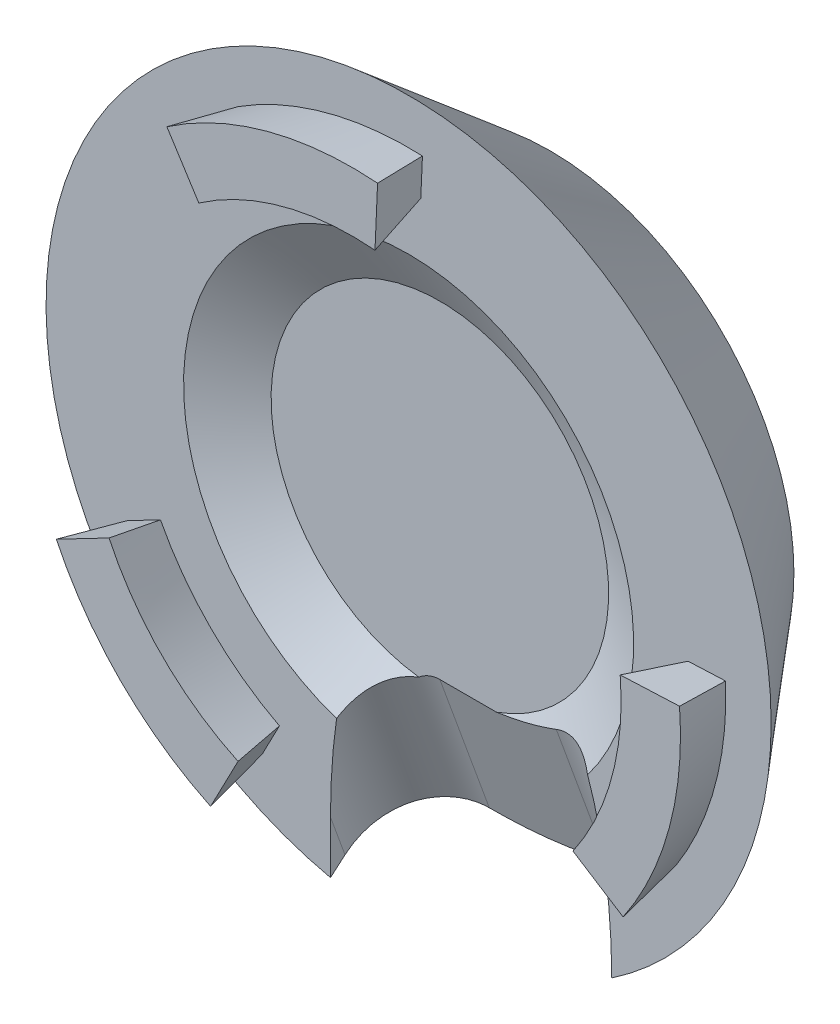
from build123d import *

# Parameters (mm, degrees)
BOSS_EXTRUDE1_DEPTH      = 0.9
BOSS_EXTRUDE1_DRAFT      = -11
CIRPATTERN1_COPY_1_DEPTH = 0.9
CIRPATTERN1_COPY_1_DRAFT = -11
CIRPATTERN1_COPY_2_DEPTH = 0.9
CIRPATTERN1_COPY_2_DRAFT = -11
CUT_EXTRUDE2_REACH       = 14.838


with BuildPart() as part:
    # Sketch1 → Revolve1 (revolve)
    with BuildSketch(Plane(origin=(0, 0, 0), x_dir=(0, 0, -1), z_dir=(1, 0, 0)), mode=Mode.PRIVATE) as revolve1_sk:
        Polygon((0, 5.8), (2.264331826, 3.9), (2.264331826, 0), (0.5, 0), (0.5, 2.7), (0, 3.6), align=None)
    revolve(revolve1_sk.sketch.rotate(Axis((0, 0, 0), (0, 0, -1)), 90), axis=Axis((0, 0, 0), (0, 0, -1)))


with BuildPart() as boss_extrude1_tool:
    # Sketch7 → Boss-Extrude1 (with draft: the straight prism first)
    with BuildSketch(Plane.XY):
        with BuildLine():
            Line((-2.726795512, 4.280211588), (-2.404415747, 3.77417672))
            ThreePointArc((-2.404415747, 3.77417672), (-1.158215227, 4.322518073), (0.195196758, 4.470740792))
            Line((0.195196758, 4.470740792), (0.221368391, 5.070169725))
            ThreePointArc((0.221368391, 5.070169725), (-1.313506654, 4.902073568), (-2.726795512, 4.280211588))
        make_face()
    extrude(amount=BOSS_EXTRUDE1_DEPTH)
    # Boss-Extrude1: the draft: its side faces are tilted about the plane it starts from
    boss_extrude1_sides = [boss_extrude1_tool.faces().sort_by_distance(p)[0] for p in [
        (0.208282575, 4.770455258, 0.45),
        (-1.313506654, 4.902073568, 0.45),
        (-2.56560563, 4.027194154, 0.45),
        (-1.158215227, 4.322518073, 0.45),
    ]]
    draft(boss_extrude1_sides, Plane.XY, BOSS_EXTRUDE1_DRAFT)


with BuildPart() as part_1:
    add(part.part)

    # Boss-Extrude1: add boss_extrude1_tool
    add(boss_extrude1_tool.part)


with BuildPart() as cirpattern1_copy_1_tool:
    # CirPattern1 copy 1 sketch → CirPattern1 copy 1 (with draft: the straight prism first)
    with BuildSketch(Plane(origin=(0, 0, 0), x_dir=(-0.4999999999999998, 0.8660254037844387, 0), z_dir=(0, 0, 1))):
        with BuildLine():
            Line((-2.726795512, 4.280211588), (-2.404415747, 3.77417672))
            ThreePointArc((-2.404415747, 3.77417672), (-1.158215227, 4.322518073), (0.195196758, 4.470740792))
            Line((0.195196758, 4.470740792), (0.221368391, 5.070169725))
            ThreePointArc((0.221368391, 5.070169725), (-1.313506654, 4.902073568), (-2.726795512, 4.280211588))
        make_face()
    extrude(amount=CIRPATTERN1_COPY_1_DEPTH)
    # CirPattern1 copy 1: the draft: its side faces are tilted about the plane it starts from
    cirpattern1_copy_1_sides = [cirpattern1_copy_1_tool.faces().sort_by_distance(p)[0] for p in [
        (-4.235476729, -2.204849628, 0.45),
        (-3.588566914, -3.588566914, 0.45),
        (-2.204849628, -4.235476729, 0.45),
        (-3.164302846, -3.164302846, 0.45),
    ]]
    draft(cirpattern1_copy_1_sides, Plane(origin=(0, 0, 0), x_dir=(-0.4999999999999998, 0.8660254037844387, 0), z_dir=(0, 0, 1)), CIRPATTERN1_COPY_1_DRAFT)


with BuildPart() as part_2:
    add(part_1.part)

    # CirPattern1 copy 1: add cirpattern1_copy_1_tool
    add(cirpattern1_copy_1_tool.part)


with BuildPart() as cirpattern1_copy_2_tool:
    # CirPattern1 copy 2 sketch → CirPattern1 copy 2 (with draft: the straight prism first)
    with BuildSketch(Plane(origin=(0, 0, 0), x_dir=(-0.5000000000000004, -0.8660254037844384, 0), z_dir=(0, 0, 1))):
        with BuildLine():
            Line((-2.726795512, 4.280211588), (-2.404415747, 3.77417672))
            ThreePointArc((-2.404415747, 3.77417672), (-1.158215227, 4.322518073), (0.195196758, 4.470740792))
            Line((0.195196758, 4.470740792), (0.221368391, 5.070169725))
            ThreePointArc((0.221368391, 5.070169725), (-1.313506654, 4.902073568), (-2.726795512, 4.280211588))
        make_face()
    extrude(amount=CIRPATTERN1_COPY_2_DEPTH)
    # CirPattern1 copy 2: the draft: its side faces are tilted about the plane it starts from
    cirpattern1_copy_2_sides = [cirpattern1_copy_2_tool.faces().sort_by_distance(p)[0] for p in [
        (4.027194154, -2.56560563, 0.45),
        (4.902073568, -1.313506654, 0.45),
        (4.770455258, 0.208282575, 0.45),
        (4.322518073, -1.158215227, 0.45),
    ]]
    draft(cirpattern1_copy_2_sides, Plane(origin=(0, 0, 0), x_dir=(-0.5000000000000004, -0.8660254037844384, 0), z_dir=(0, 0, 1)), CIRPATTERN1_COPY_2_DRAFT)


with BuildPart() as part_3:
    add(part_2.part)

    # CirPattern1 copy 2: add cirpattern1_copy_2_tool
    add(cirpattern1_copy_2_tool.part)

    # Sketch11 → Cut-Extrude2 (cut, up to next)
    with BuildSketch(Plane(origin=(0, -5.298133329, -1.928362829), x_dir=(-1, 0, 0), z_dir=(0, -0.9396926207859081, -0.34202014332566943)), mode=Mode.PRIVATE) as cut_extrude2_sk1:
        with BuildLine():
            Line((0, -0.4), (-2, -0.4))
            ThreePointArc((-2, -0.4), (-2.883883476, -0.766116524), (-3.25, -1.65))
            Line((-3.25, -1.65), (-3.25, -2.9))
            Line((-3.25, -2.9), (-2, -2.9))
            Line((-2, -2.9), (0, -2.9))
            Line((0, -2.9), (1.25, -2.9))
            Line((1.25, -2.9), (1.25, -1.65))
            ThreePointArc((1.25, -1.65), (0.883883476, -0.766116524), (0, -0.4))
        make_face()
    cut_extrude2_tool1 = extrude(cut_extrude2_sk1.sketch, amount=-CUT_EXTRUDE2_REACH, mode=Mode.PRIVATE) & part_3.part
    add(cut_extrude2_tool1.solids().sort_by_distance((1, -5.883514, -0.320042))[0], mode=Mode.SUBTRACT)


solid = part_3.part
